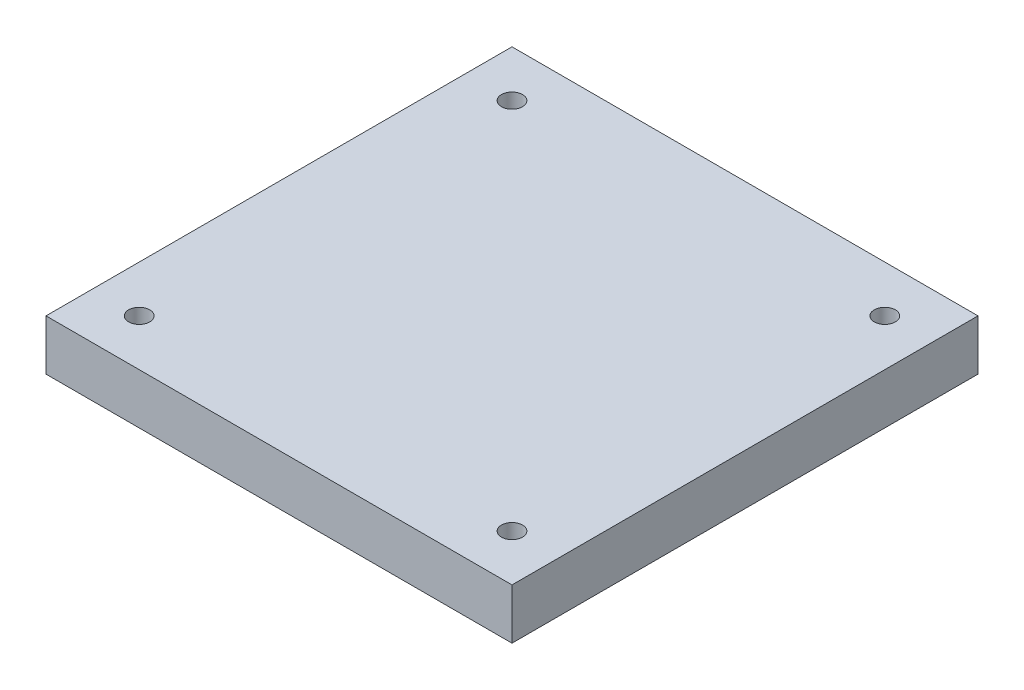
from build123d import *

# Parameters (mm, degrees)
SKETCH3_W                           = 101.6
SKETCH3_H                           = 11.1125
BOSS_EXTRUDE1_DEPTH                 = 50.8
BASEBORDERRADIUSSKETCH_OUTSIDE_W    = 132.41
BASEBORDERRADIUSSKETCH_OUTSIDE_H    = 132.41
BASEBORDERRADIUSSKETCH_OUTSIDE_W_2  = 95.25
BASEBORDERRADIUSSKETCH_OUTSIDE_H_2  = 95.25
BASEBORDERRADIUSCUT_EXTRUDE_DEPTH   = 73.57931249
BUMPER_6_32_TAPPED_HOLE_D           = 4.3053
BUMPER_6_32_TAPPED_HOLE_CBORE_D     = 7.9375
BUMPER_6_32_TAPPED_HOLE_CBORE_DEPTH = 5.3848
BUMPERTHREADLPATTERN_COUNT          = 2
BUMPERTHREADLPATTERN_PITCH          = 76.2
BUMPERTHREADLPATTERN_COUNT_DIR2     = 2
BUMPERTHREADLPATTERN_PITCH_DIR2     = 76.2


with BuildPart() as part:
    # Sketch3 → Boss-Extrude1 (new, symmetric)
    with BuildSketch(Plane.XY):
        Rectangle(SKETCH3_W, SKETCH3_H)
    extrude(amount=BOSS_EXTRUDE1_DEPTH, both=True)

    # FacingTopSurfaceCut
    split(bisect_by=Plane(origin=(0, 5.159375, 0), x_dir=(1, 0, 0), z_dir=(0, 1, 0)), keep=Keep.BOTTOM)

    # FacingBottomSurfaceCut
    split(bisect_by=Plane(origin=(0, -5.159375, 0), x_dir=(-1, 0, 0), z_dir=(0, -1, 0)), keep=Keep.BOTTOM)

    # BaseBorderRadiusSketch outside → BaseBorderRadiusCut-Extrude (cut, through all)
    with BuildSketch(Plane(origin=(0, 5.159375, 0), x_dir=(1, 0, 0), z_dir=(0, 1, 0))):
        Rectangle(BASEBORDERRADIUSSKETCH_OUTSIDE_W, BASEBORDERRADIUSSKETCH_OUTSIDE_H)
        Rectangle(BASEBORDERRADIUSSKETCH_OUTSIDE_W_2, BASEBORDERRADIUSSKETCH_OUTSIDE_H_2, mode=Mode.SUBTRACT)
    extrude(amount=-BASEBORDERRADIUSCUT_EXTRUDE_DEPTH, mode=Mode.SUBTRACT)

    # Bumper#6-32 Tapped Hole (through all)
    with Locations(Plane(origin=(-38.1, -5.159375, 38.1), x_dir=(0, 0, -1), z_dir=(0, -1, 0))):
        with Locations((0, 0)):
            bumper_6_32_tapped_hole = CounterBoreHole(BUMPER_6_32_TAPPED_HOLE_D / 2, BUMPER_6_32_TAPPED_HOLE_CBORE_D / 2, BUMPER_6_32_TAPPED_HOLE_CBORE_DEPTH)

    # BumperThreadLPattern: Bumper_6-32 Tapped Hole 2 × 2
    with Locations(*[(j * BUMPERTHREADLPATTERN_PITCH_DIR2, 0, -i * BUMPERTHREADLPATTERN_PITCH) for i in range(BUMPERTHREADLPATTERN_COUNT) for j in range(BUMPERTHREADLPATTERN_COUNT_DIR2) if (i, j) != (0, 0)]):
        add(bumper_6_32_tapped_hole, mode=Mode.SUBTRACT)


solid = part.part
